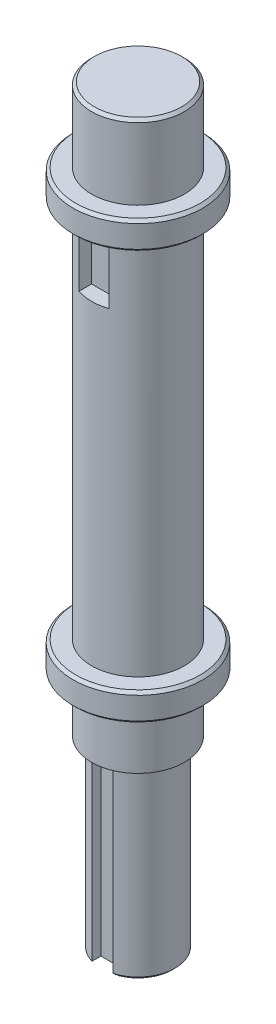
from build123d import *

# Parameters (mm, degrees)
SKETCH2_W           = 3.25
SKETCH2_H           = 3.25
CUT_EXTRUDE1_DEPTH  = 7
SKETCH3_R           = 6.416941782
CUT_EXTRUDE2_DEPTH  = 20
CHAMFER1_SIZE       = 0.3
BOSS_EXTRUDE1_START = -3
SKETCH5_R           = 7
BOSS_EXTRUDE1_DEPTH = 3
CHAMFER2_SIZE       = 0.3


with BuildPart() as part:
    # Sketch1 → Revolve1 (revolve)
    with BuildSketch(Plane.XY):
        Polygon((0, 0), (5, 0), (5, 70), (7, 70), (7, 73), (5, 73), (5, 81), (0, 81), align=None)
    revolve(axis=Axis((0, 81, 0), (0, -1, 0)))

    # Sketch2 → Cut-Extrude1 (cut)
    with BuildSketch(Plane.XZ.offset(-70)):
        with Locations((0, 5)):
            Rectangle(SKETCH2_W, SKETCH2_H)
    extrude(amount=CUT_EXTRUDE1_DEPTH, mode=Mode.SUBTRACT)

    # Sketch3 → Cut-Extrude2 (cut)
    with BuildSketch(Plane.XZ):
        Circle(SKETCH3_R)
        with BuildLine():
            ThreePointArc((1.125, 3.838538133), (0, -4), (-1.125, 3.838538133))
            Line((-1.125, 3.838538133), (-1.125, 2.875))
            Line((-1.125, 2.875), (1.125, 2.875))
            Line((1.125, 2.875), (1.125, 3.838538133))
        make_face(mode=Mode.SUBTRACT)
    extrude(amount=-CUT_EXTRUDE2_DEPTH, mode=Mode.SUBTRACT)

    # Chamfer1
    chamfer1_edges = [part.edges().sort_by_distance(p)[0] for p in [
        (-5, 81, 0),
        (-7, 70, 0),
        (-7, 73, 0),
        (-1.125, 0, 3.356769067),
        (0, 0, 2.875),
        (1.125, 0, 3.356769067),
        (0, 0, -4),
    ]]
    chamfer(chamfer1_edges, length=CHAMFER1_SIZE)

    # Sketch5 → Boss-Extrude1 (add)
    with BuildSketch(Plane(origin=(0, 26, 0), x_dir=(-1, 0, 0), z_dir=(0, -1, 0)).offset(BOSS_EXTRUDE1_START)):
        Circle(SKETCH5_R)
    extrude(amount=BOSS_EXTRUDE1_DEPTH)

    # Chamfer2
    chamfer2_edges = [part.edges().sort_by_distance(p)[0] for p in [
        (7, 26, 0),
        (7, 29, 0),
    ]]
    chamfer(chamfer2_edges, length=CHAMFER2_SIZE)


solid = part.part
